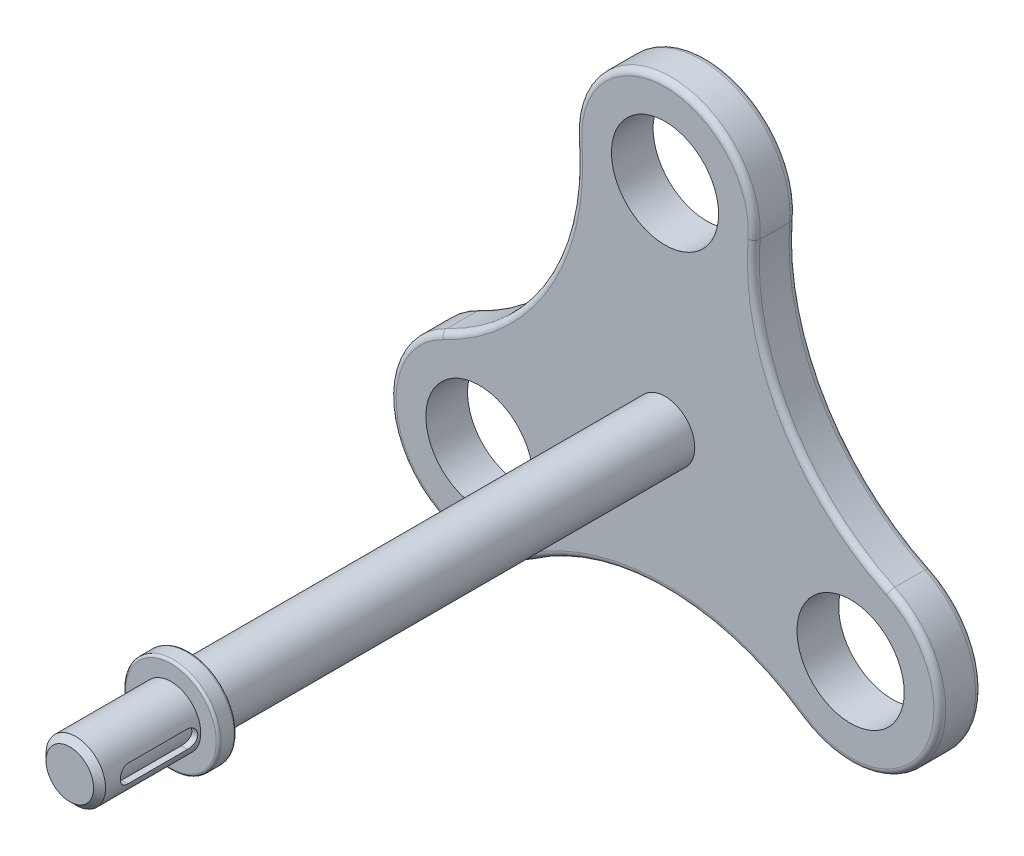
from build123d import *

# Parameters (mm, degrees)
SKETCH1_R               = 7.5
SKETCH1_R_2             = 4.5
BOSS_EXTRUDE1_DEPTH     = 3.5
SKETCH2_R               = 2.5
BOSS_EXTRUDE2_DEPTH     = 50
BOSS_EXTRUDE3_START     = -10
SKETCH3_R               = 4
BOSS_EXTRUDE3_DEPTH     = 1.5
CUT_EXTRUDE1_REACH      = 70.605
CUT_EXTRUDE1_END_RADIUS = 2
CUT_EXTRUDE1_START      = 5
CHAMFER1_SIZE           = 0.5
FILLET1_R               = 0.2
FILLET3_R               = 0.5


with BuildPart() as part:
    # Sketch1 → Boss-Extrude1 (new body)
    # profile 1 of 4: a face of its own
    with BuildSketch(Plane.XY):
        with Locations((0, 18)):
            Circle(SKETCH1_R)
        with Locations((0, 18)):
            Circle(SKETCH1_R_2, mode=Mode.SUBTRACT)
    # profile 2 of 4: a face of its own
    with BuildSketch(Plane.XY):
        with Locations((-15.588457268, -9)):
            Circle(SKETCH1_R)
        with Locations((-15.588457268, -9)):
            Circle(SKETCH1_R_2, mode=Mode.SUBTRACT)
    # profile 3 of 4: a face of its own
    with BuildSketch(Plane.XY):
        with Locations((15.588457268, -9)):
            Circle(SKETCH1_R)
        with Locations((15.588457268, -9)):
            Circle(SKETCH1_R_2, mode=Mode.SUBTRACT)
    # profile 4 of 4: a face of its own
    with BuildSketch(Plane.XY):
        with BuildLine():
            ThreePointArc((7.476559852, 17.407502934), (0, 10.5), (-7.476559852, 17.407502934))
            ThreePointArc((-7.476559852, 17.407502934), (-10.093544717, 5.827510759), (-18.813619684, -2.228860702))
            ThreePointArc((-18.813619684, -2.228860702), (-11.584628982, -2.658126534), (-8.088457268, -9))
            ThreePointArc((-8.088457268, -9), (-8.950103527, -12.490309386), (-11.337059831, -15.178642232))
            ThreePointArc((-11.337059831, -15.178642232), (0, -11.655021518), (11.337059831, -15.178642232))
            ThreePointArc((11.337059831, -15.178642232), (9.09326674, -5.25), (18.813619684, -2.228860702))
            ThreePointArc((18.813619684, -2.228860702), (10.093544717, 5.827510759), (7.476559852, 17.407502934))
        make_face()
    extrude(amount=BOSS_EXTRUDE1_DEPTH)

    # Sketch2 → Boss-Extrude2 (add)
    with BuildSketch(Plane.XY.offset(3.5)):
        Circle(SKETCH2_R)
    extrude(amount=BOSS_EXTRUDE2_DEPTH)

    # Sketch3 → Boss-Extrude3 (add)
    with BuildSketch(Plane.XY.offset(53.5).offset(BOSS_EXTRUDE3_START)):
        Circle(SKETCH3_R)
    extrude(amount=BOSS_EXTRUDE3_DEPTH)

    # Cut-Extrude1: up to this cylinder (the profile starts outside it)
    cut_extrude1_end = Plane(origin=(0, 0, 48.5), z_dir=(0, 0, -1)) * Cylinder(CUT_EXTRUDE1_END_RADIUS, 146.21, mode=Mode.PRIVATE)
    # Sketch4 → Cut-Extrude1 (cut, up to the surface)
    with BuildSketch(Plane(origin=(0, 0, 0), x_dir=(0, 0, -1), z_dir=(1, 0, 0)).offset(CUT_EXTRUDE1_START), mode=Mode.PRIVATE) as cut_extrude1_sk1:
        with BuildLine():
            Line((-51, 0.75), (-46, 0.75))
            ThreePointArc((-46, 0.75), (-45.25, 0), (-46, -0.75))
            Line((-46, -0.75), (-51, -0.75))
            ThreePointArc((-51, -0.75), (-51.75, 0), (-51, 0.75))
        make_face()
    cut_extrude1_tool1 = extrude(cut_extrude1_sk1.sketch, amount=-CUT_EXTRUDE1_REACH, mode=Mode.PRIVATE) - cut_extrude1_end
    add(cut_extrude1_tool1.solids().sort_by_distance((5, 0, 48.5))[0], mode=Mode.SUBTRACT)

    # Chamfer1
    chamfer1_edges = [part.edges().sort_by_distance(p)[0] for p in [
        (-2.5, 0, 53.5),
    ]]
    chamfer(chamfer1_edges, length=CHAMFER1_SIZE)

    # Fillet1
    fillet1_edges = [part.edges().sort_by_distance(p)[0] for p in [
        (-4, 0, 43.5),
        (-4, 0, 45),
    ]]
    fillet(fillet1_edges, radius=FILLET1_R)

    # Fillet3
    fillet3_edges = [part.edges().sort_by_distance(p)[0] for p in [
        (10.093544717, 5.827510759, 0),
        (22.083647797, -12.75, 0),
        (0, 25.5, 3.5),
        (0, -11.655021518, 0),
        (-22.083647797, -12.75, 0),
        (-10.093544717, 5.827510759, 0),
        (0, 25.5, 0),
        (-10.093544717, 5.827510759, 3.5),
        (-22.083647797, -12.75, 3.5),
        (0, -11.655021518, 3.5),
        (22.083647797, -12.75, 3.5),
        (10.093544717, 5.827510759, 3.5),
    ]]
    fillet(fillet3_edges, radius=FILLET3_R)


solid = part.part
